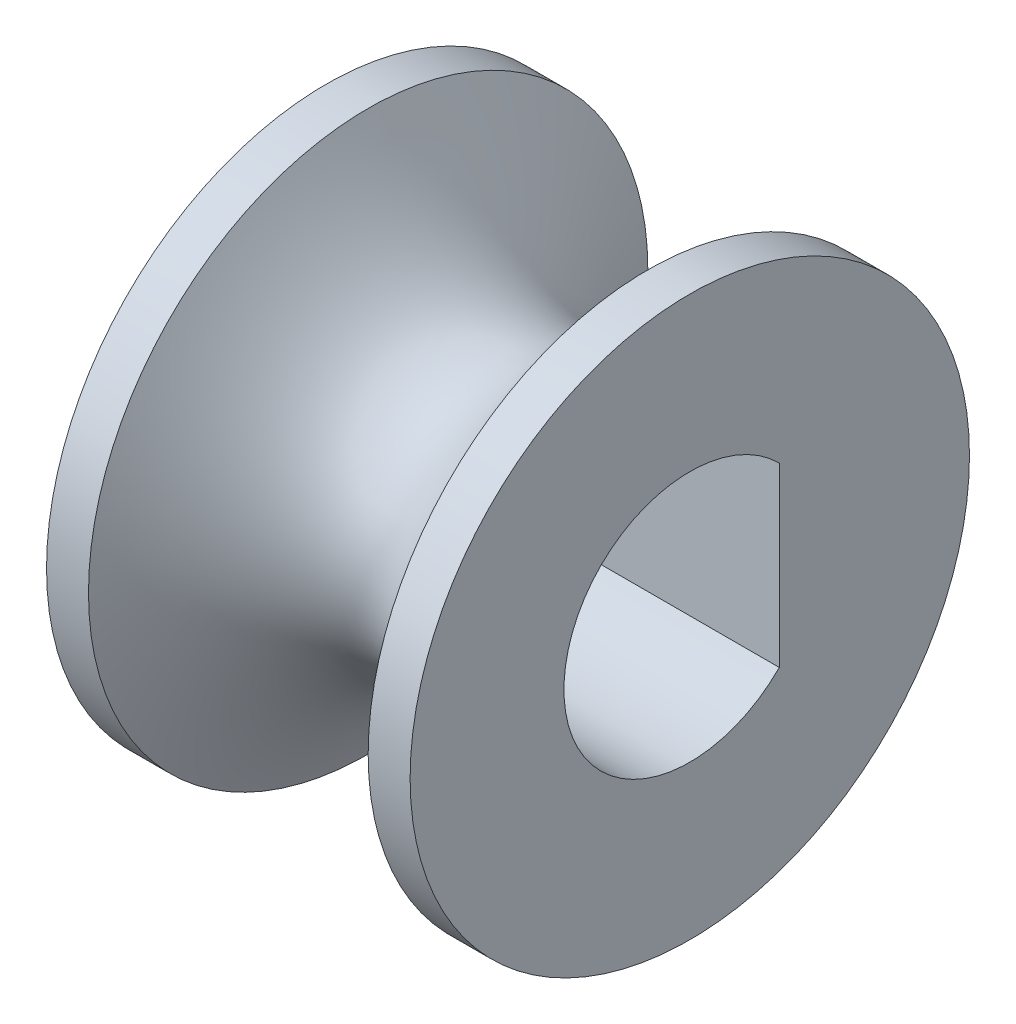
from build123d import *

# Parameters (mm, degrees)
CUT_EXTRUDE1_DEPTH = 10


with BuildPart() as part:
    # Sketch1 → Revolve1 (revolve)
    with BuildSketch(Plane(origin=(0, 0, 0), x_dir=(1, 0, 0), z_dir=(0, 1, 0))):
        with BuildLine():
            Line((0, 0), (-2.5, 0))
            Line((-2.5, 0), (-3.25, 0))
            Line((-3.25, 0), (-3.25, 5))
            Line((-3.25, 5), (-2.5, 5))
            add(Edge.make_bspline(
                [(-2.5, 5), (-9.44e-07, 0), (2.5, 5)],
                knots=[0, 0, 0, 1, 1, 1], degree=2))
            Line((2.5, 5), (3.25, 5))
            Line((3.25, 5), (3.25, 0))
            Line((3.25, 0), (2.5, 0))
            Line((2.5, 0), (0, 0))
        make_face()
    revolve(axis=Axis((0, 0, 0), (-1, 0, 0)))

    # Sketch2 → Cut-Extrude1 (cut)
    with BuildSketch(Plane.ZY.offset(3.25)):
        with BuildLine():
            Line((-1.6, -1.581929202), (-1.6, 1.581929202))
            ThreePointArc((-1.6, 1.581929202), (2.25, 0), (-1.6, -1.581929202))
        make_face()
    extrude(amount=-CUT_EXTRUDE1_DEPTH, mode=Mode.SUBTRACT)


solid = part.part
